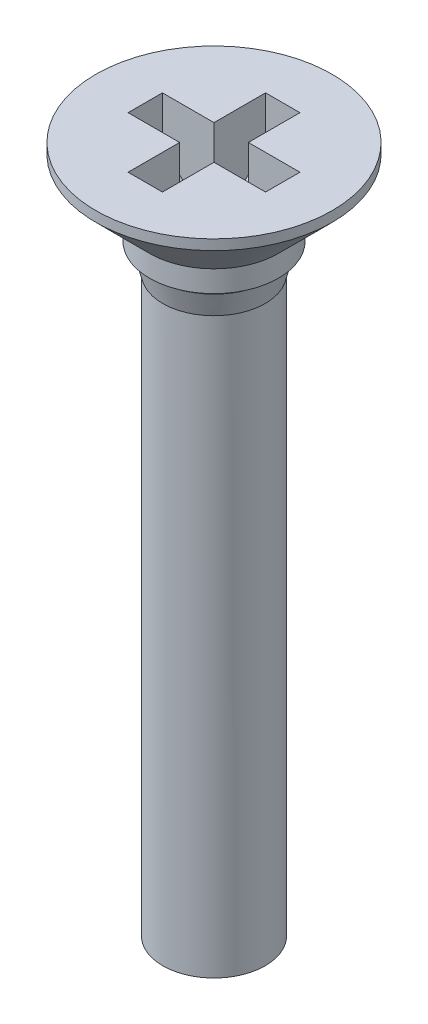
from build123d import *

# Parameters (mm, degrees)
KREUZSCHLITZ1_H_DEPTH      = 0.4
KREUZSCHLITZ1_H_DEPTH_BACK = 0.4
KREUZSCHLITZ2_H_DEPTH      = 0.4
KREUZSCHLITZ2_H_DEPTH_BACK = 0.4
BOSS_EXTRUDE1_START        = 8
SKETCH1_R                  = 1.1935
BOSS_EXTRUDE1_DEPTH        = 8


with BuildPart() as part:
    # Skizze1 → Basis-Rotation (revolve)
    with BuildSketch(Plane.XY, mode=Mode.PRIVATE) as basis_rotation_sk:
        Polygon((0, 0), (2.75, 0), (2.75, -0.2375), (1.5, -1.4875), (1.5, -1.9875), (1.3375, -1.9875), (1.3375, -2.112584684), (1.1935, -2.65), (1.1935, -8), (0, -8), align=None)
    revolve(basis_rotation_sk.sketch.rotate(Axis((0, 0, 0), (0, -1, 0)), 180), axis=Axis((0, 0, 0), (0, -1, 0)))

    # Skizze2 → Kreuzschlitz1 H (cut, two sides: drawn at the far end of the back side and taken through both)
    with BuildSketch(Plane.XY.offset(-KREUZSCHLITZ1_H_DEPTH_BACK)):
        Polygon((-0.55, -2.1), (0.55, -2.1), (1.6, -1.05), (1.6, 0), (-1.6, 0), (-1.6, -1.05), align=None)
    extrude(amount=KREUZSCHLITZ1_H_DEPTH + KREUZSCHLITZ1_H_DEPTH_BACK, mode=Mode.SUBTRACT)

    # Skizze3 → Kreuzschlitz2 H (cut, two sides: drawn at the far end of the back side and taken through both)
    with BuildSketch(Plane(origin=(0, 0, 0), x_dir=(0, 0, -1), z_dir=(1, 0, 0)).offset(-KREUZSCHLITZ2_H_DEPTH_BACK)):
        Polygon((-0.55, -2.1), (0.55, -2.1), (1.6, -1.05), (1.6, 0), (-1.6, 0), (-1.6, -1.05), align=None)
    extrude(amount=KREUZSCHLITZ2_H_DEPTH + KREUZSCHLITZ2_H_DEPTH_BACK, mode=Mode.SUBTRACT)

    # Sketch1 → Boss-Extrude1 (add)
    with BuildSketch(Plane.XZ.offset(8).offset(BOSS_EXTRUDE1_START)):
        with Locations(Location((0, 0, 0), (0, 0, 180))):
            Circle(SKETCH1_R)
    extrude(amount=-BOSS_EXTRUDE1_DEPTH)


solid = part.part
